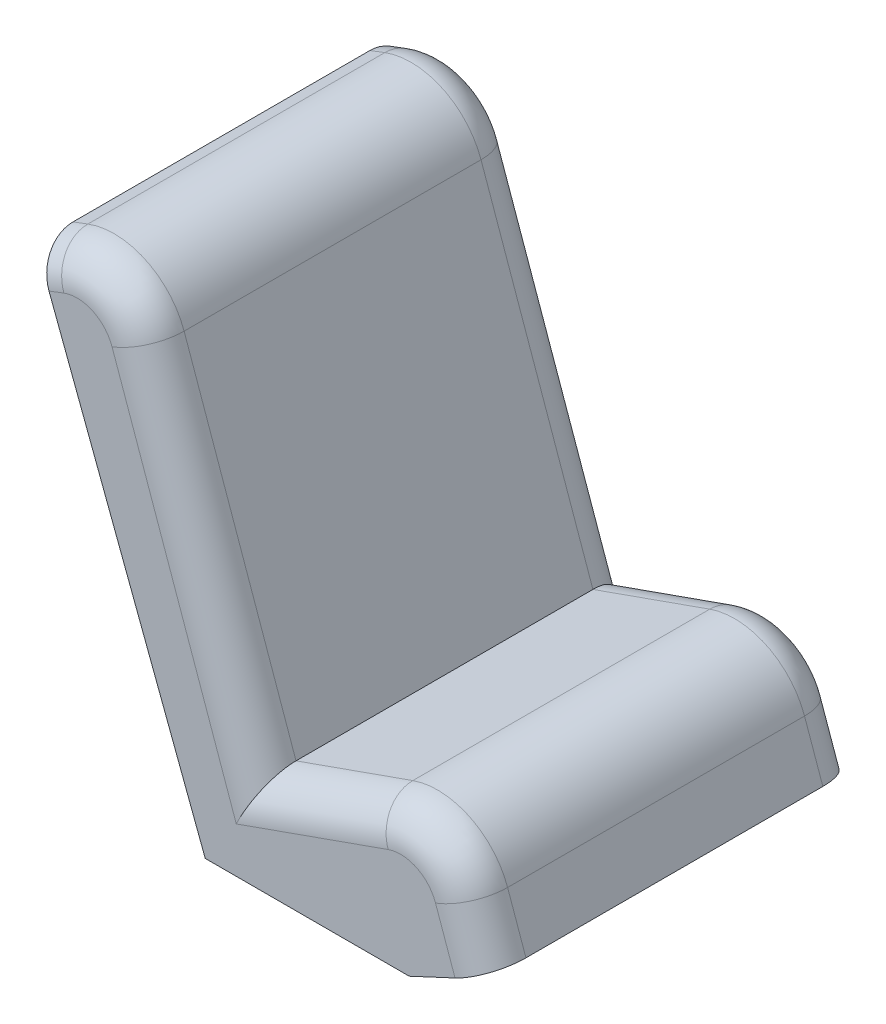
from build123d import *

# Parameters (mm, degrees)
Y_KSEKLIK_EKSTR_ZYON1_DEPTH = 50
IZIM2_R                     = 7.5
Y_KSEKLIK_EKSTR_ZYON2_DEPTH = 10
RADYUS1_R                   = 10
PAH1_SIZE                   = 2


with BuildPart() as part:
    # Çizim1 → Yükseklik-Ekstrüzyon1 (new, symmetric)
    with BuildSketch(Plane.XY):
        with BuildLine():
            Line((-45.372360711, 120), (0, 0))
            Line((0, 0), (57.1, 0))
            Line((57.1, 0), (78.545069205, 10))
            Line((78.545069205, 10), (73.604661371, 23.960547839))
            ThreePointArc((73.604661371, 23.960547839), (63.364429783, 35.33825552), (48.078238331, 36.14257258))
            Line((48.078238331, 36.14257258), (16.591684434, 25))
            Line((16.591684434, 25), (-13.556112922, 110.191300263))
            ThreePointArc((-13.556112922, 110.191300263), (-23.989587023, 121.659965839), (-39.483672218, 122.22653082))
            Line((-39.483672218, 122.22653082), (-45.372360711, 120))
        make_face()
    extrude(amount=Y_KSEKLIK_EKSTR_ZYON1_DEPTH, both=True)

    # Çizim2 → Yükseklik-Ekstrüzyon2 (add)
    with BuildSketch(Plane.XZ):
        with Locations(Location((30, 0, 0), (0, 0, 90))):
            Circle(IZIM2_R)
    extrude(amount=Y_KSEKLIK_EKSTR_ZYON2_DEPTH)

    # Radyus1
    radyus1_edges = [part.edges().sort_by_distance(p)[0] for p in [
        (76.074865288, 16.980273919, -50),
        (-42.428016465, 121.11326541, -50),
        (76.074865288, 16.980273919, 50),
        (63.364429783, 35.33825552, 50),
        (32.334961383, 30.57128629, 50),
        (1.517785756, 67.595650131, 50),
        (-23.989587023, 121.659965839, 50),
        (-42.428016465, 121.11326541, 50),
        (-23.989587023, 121.659965839, -50),
        (1.517785756, 67.595650131, -50),
        (32.334961383, 30.57128629, -50),
        (63.364429783, 35.33825552, -50),
    ]]
    fillet(radyus1_edges, radius=RADYUS1_R)

    # Pah1
    pah1_edges = [part.edges().sort_by_distance(p)[0] for p in [
        (-20.917846504, 55.323142573, -50),
        (-20.917846504, 55.323142573, 50),
        (-45.372360711, 120, 0),
        (-44.336494724, 117.260360349, 47.071067812),
        (-44.336494724, 117.260360349, -47.071067812),
    ]]
    chamfer(pah1_edges, length=PAH1_SIZE)


solid = part.part
